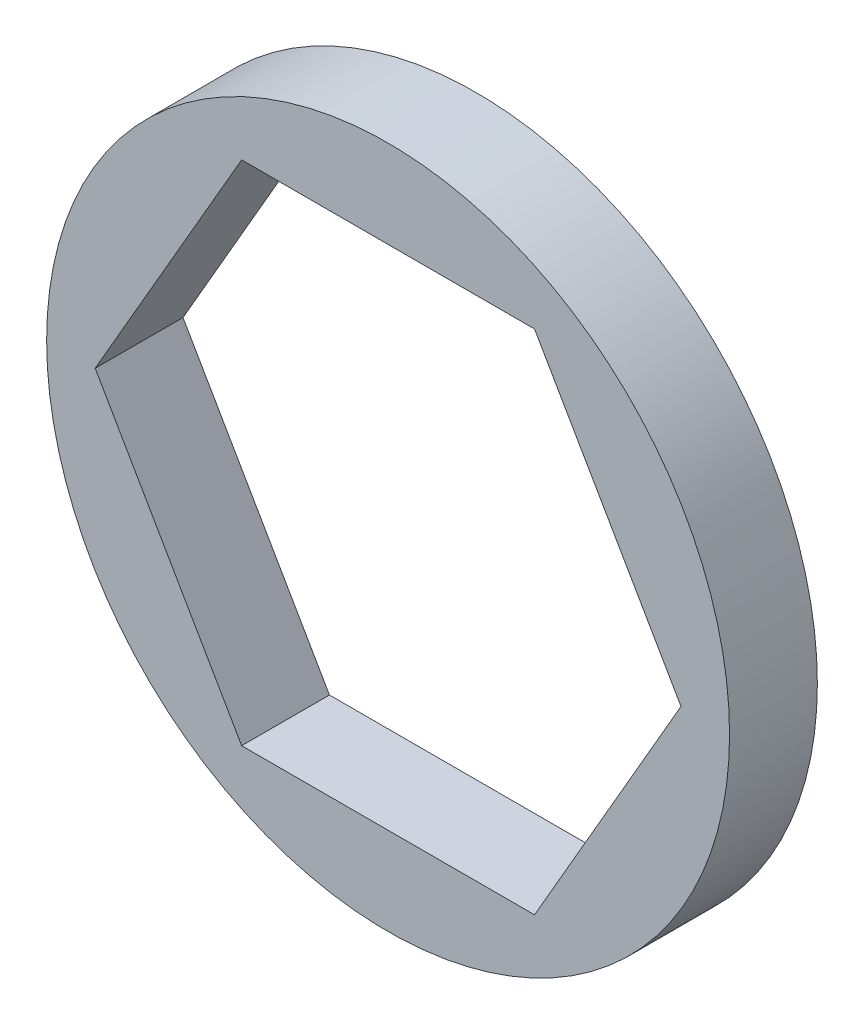
from build123d import *

# Parameters (mm, degrees)
SKETCH3_R           = 8.89
BOSS_EXTRUDE2_DEPTH = 2.286


with BuildPart() as part:
    # Sketch3 → Boss-Extrude2 (new body)
    with BuildSketch(Plane.XY):
        Circle(SKETCH3_R)
        Polygon((7.625642355, 0), (3.812821178, 6.604), (-3.812821178, 6.604), (-7.625642355, 0), (-3.812821178, -6.604), (3.812821178, -6.604), align=None, mode=Mode.SUBTRACT)
    extrude(amount=BOSS_EXTRUDE2_DEPTH)


solid = part.part
